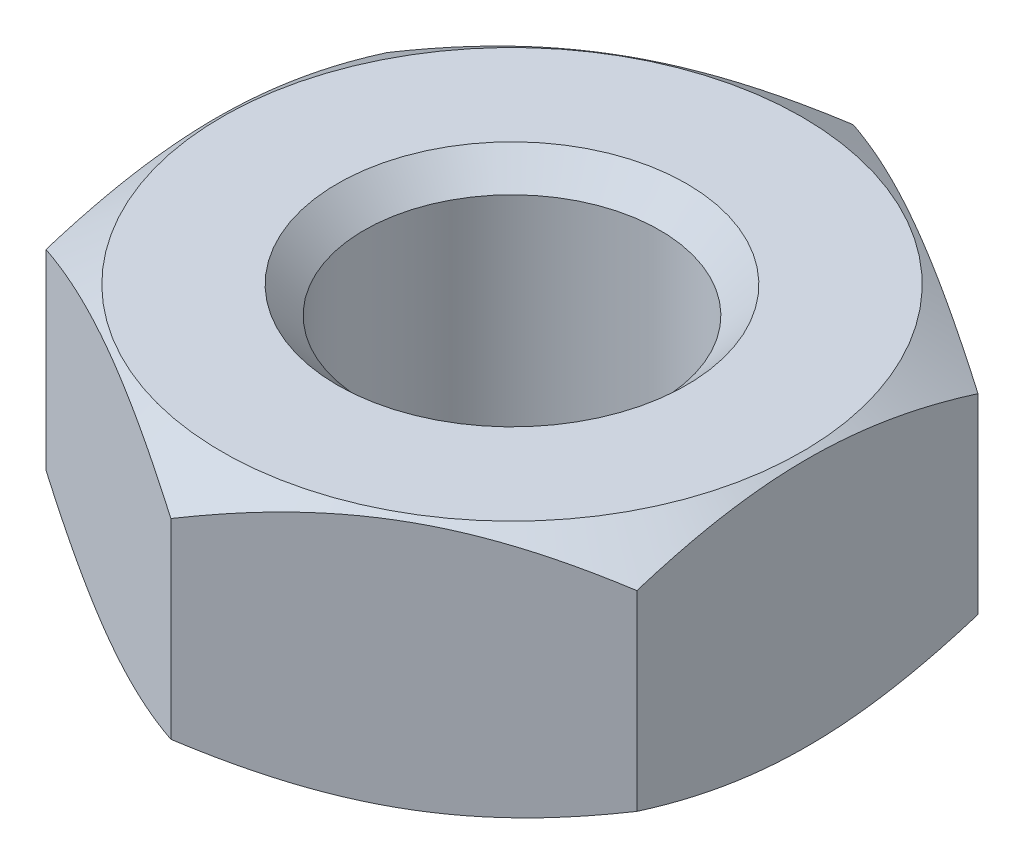
from build123d import *

# Parameters (mm, degrees)
SKETCH1_R           = 1.375
BOSS_EXTRUDE1_DEPTH = 1.19
CHAMFER1_SIZE       = 0.25


with BuildPart() as part:
    # Sketch1 → Boss-Extrude1 (new, symmetric)
    with BuildSketch(Plane(origin=(0, 0, 0), x_dir=(1, 0, 0), z_dir=(0, 1, 0))):
        Polygon((0, 3.175426481), (-2.75, 1.58771324), (-2.75, -1.58771324), (0, -3.175426481), (2.75, -1.58771324), (2.75, 1.58771324), align=None)
        with Locations(Location((0, 0, 0), (0, 0, 270))):
            Circle(SKETCH1_R, mode=Mode.SUBTRACT)
    extrude(amount=BOSS_EXTRUDE1_DEPTH, both=True)

    # Sketch2 → Cut-Revolve1 (revolve, cut)
    with BuildSketch(Plane(origin=(0, 0, 0), x_dir=(0, 0, -1), z_dir=(1, 0, 0))):
        Polygon((2.7, 1.19), (3.175426481, 0.89), (3.175426481, 1.19), align=None)
    cut_revolve1 = revolve(axis=Axis((0, 0, 0), (0, 1, 0)), mode=Mode.SUBTRACT)

    # Mirror1: Cut-Revolve1 across plane
    add(cut_revolve1.mirror(Plane.ZX), mode=Mode.SUBTRACT)

    # Chamfer1
    chamfer1_edges = [part.edges().sort_by_distance(p)[0] for p in [
        (0, -1.19, -1.375),
        (0, 1.19, -1.375),
    ]]
    chamfer(chamfer1_edges, length=CHAMFER1_SIZE)


solid = part.part
